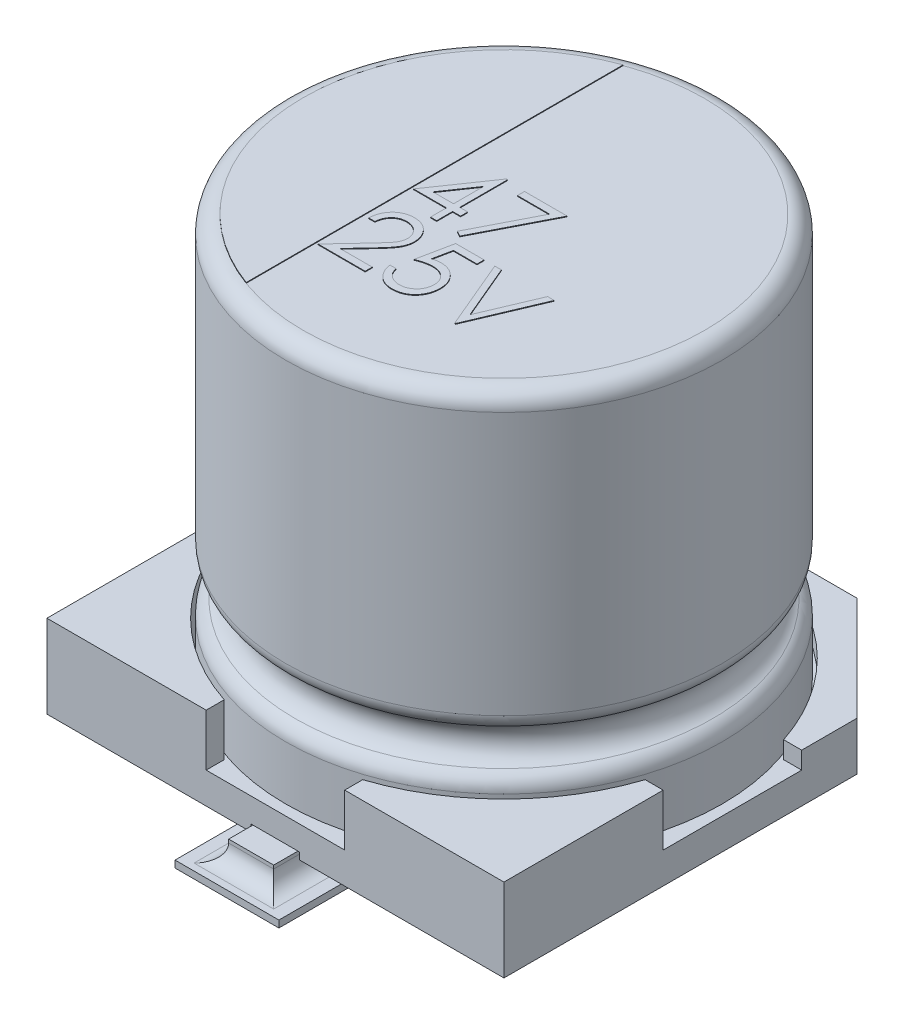
from build123d import *

# Parameters (mm, degrees)
BOSS_EXTRUDE1_START   = 0.3
SKETCH1_W             = 6.6
SKETCH1_H             = 6.6
BOSS_EXTRUDE1_DEPTH   = 1.2
SKETCH2_W             = 2
SKETCH2_H             = 2
CUT_EXTRUDE1_DEPTH    = 0.75
CUT_EXTRUDE2_DEPTH    = 0.5
CHAMFER1_SIZE         = 1.5
CUT_EXTRUDE3_DEPTH    = 0.1
BOSS_EXTRUDE2_DEPTH   = 0.4
BOSS_EXTRUDE2_2_DEPTH = 0.4
SKETCH7_R             = 0.5
BOSS_EXTRUDE3_DEPTH   = 0.3
SKETCH8_W             = 1.5
SKETCH8_H             = 2
BOSS_EXTRUDE4_DEPTH   = 0.1
FILLET1_R             = 0.25
FILLET2_R             = 0.25
BOSS_EXTRUDE5_DEPTH   = 0.01
BOSS_EXTRUDE5_2_DEPTH = 0.01
BOSS_EXTRUDE5_3_DEPTH = 0.01
BOSS_EXTRUDE5_4_DEPTH = 0.01
BOSS_EXTRUDE5_5_DEPTH = 0.01
BOSS_EXTRUDE5_6_DEPTH = 0.01


with BuildPart() as part:
    # Sketch1 → Boss-Extrude1 (new body)
    with BuildSketch(Plane(origin=(0, 0, 0), x_dir=(1, 0, 0), z_dir=(0, 1, 0)).offset(BOSS_EXTRUDE1_START)):
        Rectangle(SKETCH1_W, SKETCH1_H)
    extrude(amount=BOSS_EXTRUDE1_DEPTH)

    # Sketch2 → Cut-Extrude1 (cut)
    with BuildSketch(Plane(origin=(0, 1.5, 0), x_dir=(1, 0, 0), z_dir=(0, 1, 0))):
        Rectangle(SKETCH2_W, SKETCH2_H)
        with BuildLine():
            Line((1, -1), (-1, -1))
            Line((-1, -1), (-1, -3.039736831))
            ThreePointArc((-1, -3.039736831), (0, -3.2), (1, -3.039736831))
            Line((1, -3.039736831), (1, -1))
        make_face()
        with BuildLine():
            Line((3.039736831, 1), (1, 1))
            Line((1, 1), (1, -1))
            Line((1, -1), (3.039736831, -1))
            ThreePointArc((3.039736831, -1), (3.159680194, -0.506380362), (3.2, 0))
            ThreePointArc((3.2, 0), (3.159680194, 0.506380362), (3.039736831, 1))
        make_face()
        with BuildLine():
            Line((-1, 3.039736831), (-1, 1))
            Line((-1, 1), (1, 1))
            Line((1, 1), (1, 3.039736831))
            ThreePointArc((1, 3.039736831), (0, 3.2), (-1, 3.039736831))
        make_face()
        with BuildLine():
            Line((-1, 1), (-3.039736831, 1))
            ThreePointArc((-3.039736831, 1), (-3.2, 0), (-3.039736831, -1))
            Line((-3.039736831, -1), (-1, -1))
            Line((-1, -1), (-1, 1))
        make_face()
        with BuildLine():
            Line((-3.039736831, 1), (-3.3, 1))
            Line((-3.3, 1), (-3.3, -1))
            Line((-3.3, -1), (-3.039736831, -1))
            ThreePointArc((-3.039736831, -1), (-3.2, 0), (-3.039736831, 1))
        make_face()
        with BuildLine():
            Line((-1, 3.3), (-1, 3.039736831))
            ThreePointArc((-1, 3.039736831), (0, 3.2), (1, 3.039736831))
            Line((1, 3.039736831), (1, 3.3))
            Line((1, 3.3), (-1, 3.3))
        make_face()
        with BuildLine():
            Line((3.3, 1), (3.039736831, 1))
            ThreePointArc((3.039736831, 1), (3.159680194, 0.506380362), (3.2, 0))
            ThreePointArc((3.2, 0), (3.159680194, -0.506380362), (3.039736831, -1))
            Line((3.039736831, -1), (3.3, -1))
            Line((3.3, -1), (3.3, 1))
        make_face()
        with BuildLine():
            ThreePointArc((1, -3.039736831), (0, -3.2), (-1, -3.039736831))
            Line((-1, -3.039736831), (-1, -3.3))
            Line((-1, -3.3), (1, -3.3))
            Line((1, -3.3), (1, -3.039736831))
        make_face()
        with BuildLine():
            Line((-1, -1), (-3.039736831, -1))
            ThreePointArc((-3.039736831, -1), (-2.2627417, -2.2627417), (-1, -3.039736831))
            Line((-1, -3.039736831), (-1, -1))
        make_face()
        with BuildLine():
            ThreePointArc((-1, 3.039736831), (-2.2627417, 2.2627417), (-3.039736831, 1))
            Line((-3.039736831, 1), (-1, 1))
            Line((-1, 1), (-1, 3.039736831))
        make_face()
        with BuildLine():
            Line((1, 3.039736831), (1, 1))
            Line((1, 1), (3.039736831, 1))
            ThreePointArc((3.039736831, 1), (2.2627417, 2.2627417), (1, 3.039736831))
        make_face()
        with BuildLine():
            Line((3.039736831, -1), (1, -1))
            Line((1, -1), (1, -3.039736831))
            ThreePointArc((1, -3.039736831), (2.2627417, -2.2627417), (3.039736831, -1))
        make_face()
    extrude(amount=-CUT_EXTRUDE1_DEPTH, mode=Mode.SUBTRACT)

    # Sketch3 → Cut-Extrude2 (cut)
    with BuildSketch(Plane(origin=(0, 1.5, 0), x_dir=(1, 0, 0), z_dir=(0, 1, 0))):
        with BuildLine():
            Line((-3.3, 3.3), (-3.3, 1))
            Line((-3.3, 1), (-3.039736831, 1))
            ThreePointArc((-3.039736831, 1), (-2.2627417, 2.2627417), (-1, 3.039736831))
            Line((-1, 3.039736831), (-1, 3.3))
            Line((-1, 3.3), (-3.3, 3.3))
        make_face()
        with BuildLine():
            Line((3.3, 3.3), (1, 3.3))
            Line((1, 3.3), (1, 3.039736831))
            ThreePointArc((1, 3.039736831), (2.2627417, 2.2627417), (3.039736831, 1))
            Line((3.039736831, 1), (3.3, 1))
            Line((3.3, 1), (3.3, 3.3))
        make_face()
    extrude(amount=-CUT_EXTRUDE2_DEPTH, mode=Mode.SUBTRACT)

    # Chamfer1
    chamfer1_edges = [part.edges().sort_by_distance(p)[0] for p in [
        (-3.3, 0.65, -3.3),
        (3.3, 0.65, -3.3),
    ]]
    chamfer(chamfer1_edges, length=CHAMFER1_SIZE)

    # Sketch5 → Cut-Extrude3 (cut)
    with BuildSketch(Plane.XZ.offset(-0.3)):
        with BuildLine():
            Line((-0.35, -3.3), (0.35, -3.3))
            Line((0.35, -3.3), (0.498675617, -1.261367968))
            ThreePointArc((0.498675617, -1.261367968), (0, -0.725), (-0.498675617, -1.261367968))
            Line((-0.498675617, -1.261367968), (-0.35, -3.3))
        make_face()
        with BuildLine():
            Line((-0.35, 3.3), (0.35, 3.3))
            Line((0.35, 3.3), (0.498675617, 1.261367968))
            ThreePointArc((0.498675617, 1.261367968), (0, 0.725), (-0.498675617, 1.261367968))
            Line((-0.498675617, 1.261367968), (-0.35, 3.3))
        make_face()
    extrude(amount=-CUT_EXTRUDE3_DEPTH, mode=Mode.SUBTRACT)

    # Sketch7 → Boss-Extrude3 (add)
    with BuildSketch(Plane.XZ.offset(-0.3)):
        with Locations(Location((-2, 2, 0), (0, 0, 90))):
            Circle(SKETCH7_R)
        with Locations(Location((2, 2, 0), (0, 0, 90))):
            Circle(SKETCH7_R)
        with Locations(Location((2, -2, 0), (0, 0, 90))):
            Circle(SKETCH7_R)
        with Locations(Location((-2, -2, 0), (0, 0, 90))):
            Circle(SKETCH7_R)
    extrude(amount=BOSS_EXTRUDE3_DEPTH)


with BuildPart() as body_2:
    # Sketch4 → Revolve1 (revolve)
    with BuildSketch(Plane(origin=(0, 0, 0), x_dir=(0, 0, -1), z_dir=(1, 0, 0)), mode=Mode.PRIVATE) as revolve1_sk:
        with BuildLine():
            Line((-3.15, 0.75), (0, 0.75))
            Line((0, 0.75), (0, 6.55))
            Line((0, 6.55), (-2.9, 6.55))
            ThreePointArc((-2.9, 6.55), (-3.076776695, 6.476776695), (-3.15, 6.3))
            Line((-3.15, 6.3), (-3.15, 2.507115011))
            ThreePointArc((-3.15, 2.507115011), (-3.113200716, 2.376556769), (-3.013636364, 2.284434126))
            ThreePointArc((-3.013636364, 2.284434126), (-2.85, 2.017217063), (-3.013636364, 1.75))
            ThreePointArc((-3.013636364, 1.75), (-3.113200716, 1.657877356), (-3.15, 1.527319114))
            Line((-3.15, 1.527319114), (-3.15, 0.75))
        make_face()
    revolve(revolve1_sk.sketch.rotate(Axis((0, 0.75, 0), (0, 1, 0)), 180), axis=Axis((0, 0.75, 0), (0, 1, 0)))


with BuildPart() as body_3:
    # Sketch6 → Boss-Extrude2 (new body)
    with BuildSketch(Plane.XZ.offset(-0.4)):
        with BuildLine():
            Line((-0.325, 3.65), (0.325, 3.65))
            Line((0.325, 3.65), (0.325, 1.225))
            ThreePointArc((0.325, 1.225), (0, 0.9), (-0.325, 1.225))
            Line((-0.325, 1.225), (-0.325, 3.65))
        make_face()
    extrude(amount=BOSS_EXTRUDE2_DEPTH)



with BuildPart() as body_4:
    # Sketch6 → Boss-Extrude2 2 (new body)
    with BuildSketch(Plane.XZ.offset(-0.4)):
        with BuildLine():
            Line((0.325, -3.65), (0.325, -1.225))
            ThreePointArc((0.325, -1.225), (0, -0.9), (-0.325, -1.225))
            Line((-0.325, -1.225), (-0.325, -3.65))
            Line((-0.325, -3.65), (0.325, -3.65))
        make_face()
    extrude(amount=BOSS_EXTRUDE2_2_DEPTH)


with BuildPart() as body_3_1:
    add(body_3.part)

    add(body_4.part)  # Boss-Extrude4 merges body 4
    # Sketch8 → Boss-Extrude4 (add)
    with BuildSketch(Plane.XZ):
        with Locations((0, -3)):
            Rectangle(SKETCH8_W, SKETCH8_H)
        with Locations((0, 3)):
            Rectangle(SKETCH8_W, SKETCH8_H)
    extrude(amount=-BOSS_EXTRUDE4_DEPTH)

    # Fillet1
    fillet1_edges = [body_3_1.edges().sort_by_distance(p)[0] for p in [
        (-0.325, 0.1, 2.825),
        (0, 0.1, 3.65),
        (0.325, 0.1, 2.825),
    ]]
    fillet(fillet1_edges, radius=FILLET1_R)

    # Fillet2
    fillet2_edges = [body_3_1.edges().sort_by_distance(p)[0] for p in [
        (0.325, 0.1, -2.825),
        (0, 0.1, -3.65),
        (-0.325, 0.1, -2.825),
    ]]
    fillet(fillet2_edges, radius=FILLET2_R)


with BuildPart() as body_4_2:
    # Sketch9 → Boss-Extrude5 (new body)
    with BuildSketch(Plane(origin=(0, 6.55, 0), x_dir=(1, 0, 0), z_dir=(0, 1, 0))):
        with BuildLine():
            Line((-1, -2.722131518), (-1, -1.722131518))
            Line((-1, -1.722131518), (-1, -0.574043839))
            Line((-1, -0.574043839), (-1, 0.574043839))
            Line((-1, 0.574043839), (-1, 1.722131518))
            Line((-1, 1.722131518), (-1, 2.722131518))
            ThreePointArc((-1, 2.722131518), (-2.9, 0), (-1, -2.722131518))
        make_face()
    extrude(amount=BOSS_EXTRUDE5_DEPTH)


with BuildPart() as body_5:
    # Sketch9 → Boss-Extrude5 2 (new body)
    with BuildSketch(Plane(origin=(0, 6.55, 0), x_dir=(1, 0, 0), z_dir=(0, 1, 0))):
        Polygon((-0.415665064, 0.451597186), (-0.397435897, 0.451597186), (-0.397435897, -0.240710506), (-0.282051282, -0.240710506), (-0.282051282, -0.343274608), (-0.397435897, -0.343274608), (-0.397435897, -0.574043839), (-0.487179487, -0.574043839), (-0.487179487, -0.343274608), (-0.961538462, -0.343274608), align=None)
        Polygon((-0.487179487, -0.240710506), (-0.487179487, 0.193584366), (-0.78525641, -0.240710506), align=None, mode=Mode.SUBTRACT)
    extrude(amount=BOSS_EXTRUDE5_2_DEPTH)


with BuildPart() as body_6:
    # Sketch9 → Boss-Extrude5 3 (new body)
    with BuildSketch(Plane(origin=(0, 6.55, 0), x_dir=(1, 0, 0), z_dir=(0, 1, 0))):
        Polygon((-0.128205128, 0.425956161), (0.487179487, 0.425956161), (-0.038461538, -0.599684865), (-0.115985577, -0.557016596), (0.335336538, 0.323392058), (-0.128205128, 0.323392058), align=None)
    extrude(amount=BOSS_EXTRUDE5_3_DEPTH)


with BuildPart() as body_7:
    # Sketch9 → Boss-Extrude5 4 (new body)
    with BuildSketch(Plane(origin=(0, 6.55, 0), x_dir=(1, 0, 0), z_dir=(0, 1, 0))):
        with BuildLine():
            Line((-0.833333333, -1.029823825), (-0.923076923, -1.029823825))
            add(Edge.make_bspline(
                [(-0.923076923, -1.029823825), (-0.922492022, -1.017917858), (-0.921343292, -0.994534853), (-0.915963781, -0.960442309), (-0.908266388, -0.927855223), (-0.897383115, -0.897035248), (-0.883867036, -0.867709874), (-0.867658457, -0.839995584), (-0.848460214, -0.813998102), (-0.826686861, -0.789958432), (-0.803038678, -0.767904841), (-0.777522696, -0.748860485), (-0.750709831, -0.732769722), (-0.722681431, -0.719317939), (-0.69312127, -0.70922084), (-0.662297596, -0.701728943), (-0.630074986, -0.697221416), (-0.608120694, -0.696736905), (-0.596955128, -0.696490492)],
                knots=[0, 0, 0, 0, 1.10065271, 2.161652631, 3.183658789, 4.190468796, 5.17591951, 6.163126047, 7.15150782, 8.156236427, 9.156009102, 10.134482811, 11.092018607, 12.041330605, 13.001268258, 13.972401359, 14.968799086, 16, 16, 16, 16], degree=3))
            add(Edge.make_bspline(
                [(-0.596955128, -0.696490492), (-0.585989964, -0.696747194), (-0.564443809, -0.697251604), (-0.532997519, -0.701583327), (-0.503061149, -0.708367781), (-0.474693216, -0.717886472), (-0.448120054, -0.730682022), (-0.423142042, -0.746052748), (-0.39946181, -0.763829842), (-0.378145586, -0.784759503), (-0.358571849, -0.807103042), (-0.34168549, -0.830956729), (-0.327224587, -0.855593667), (-0.315170964, -0.881201725), (-0.306297781, -0.908022019), (-0.29956115, -0.935664077), (-0.295753318, -0.964414023), (-0.295168911, -0.983873039), (-0.294871795, -0.993766133)],
                knots=[0, 0, 0, 0, 1.111607364, 2.184268762, 3.212621178, 4.221274766, 5.211760367, 6.196651075, 7.1921475, 8.207485113, 9.220403448, 10.201281604, 11.166441695, 12.114753415, 13.065576456, 14.026450734, 14.996634279, 16, 16, 16, 16], degree=3))
            add(Edge.make_bspline(
                [(-0.294871795, -0.993766133), (-0.295355584, -1.007694086), (-0.296314673, -1.035305576), (-0.304518781, -1.075881251), (-0.31733207, -1.115193656), (-0.332759886, -1.146832885), (-0.348323441, -1.172328169), (-0.362348444, -1.193319228), (-0.378766961, -1.21592079), (-0.39781796, -1.240057172), (-0.419107352, -1.265917431), (-0.442827971, -1.293485944), (-0.469148965, -1.322477878), (-0.487622823, -1.342279478), (-0.497195513, -1.352540172)],
                knots=[0, 0, 0, 0, 1.184426356, 2.348067706, 3.509069118, 4.696110526, 5.333549288, 6.050745305, 6.844228056, 7.710549037, 8.667450064, 9.695053472, 10.805634456, 12, 12, 12, 12], degree=3))
            Line((-0.497195513, -1.352540172), (-0.747395833, -1.619567415))
            Line((-0.747395833, -1.619567415), (-0.282051282, -1.619567415))
            Line((-0.282051282, -1.619567415), (-0.282051282, -1.722131518))
            Line((-0.282051282, -1.722131518), (-0.961538462, -1.722131518))
            Line((-0.961538462, -1.722131518), (-0.573717949, -1.308269338))
            add(Edge.make_bspline(
                [(-0.573717949, -1.308269338), (-0.564275695, -1.298412679), (-0.546139059, -1.279480055), (-0.520486894, -1.251839209), (-0.497447183, -1.226196483), (-0.476870785, -1.202600326), (-0.45920407, -1.180705592), (-0.443526289, -1.161221391), (-0.430964692, -1.143291549), (-0.417331721, -1.122508516), (-0.404127727, -1.097133568), (-0.392781339, -1.066123943), (-0.385862811, -1.034201871), (-0.385032858, -1.01262986), (-0.384615385, -1.001778954)],
                knots=[0, 0, 0, 0, 1.329631726, 2.553950428, 3.673215718, 4.687767853, 5.603093632, 6.413772471, 7.123043292, 7.734684054, 8.834405432, 9.900288307, 10.943827018, 12, 12, 12, 12], degree=3))
            add(Edge.make_bspline(
                [(-0.384615385, -1.001778954), (-0.384797025, -0.994955697), (-0.385155004, -0.981508368), (-0.388314346, -0.961792437), (-0.393088777, -0.942773919), (-0.399930279, -0.924394313), (-0.408960776, -0.906838413), (-0.41995317, -0.890084847), (-0.432636046, -0.873888), (-0.447307837, -0.858701343), (-0.463425414, -0.844792427), (-0.480452342, -0.83247126), (-0.498466658, -0.822174371), (-0.517392407, -0.813733372), (-0.537176827, -0.807111835), (-0.557858183, -0.802523669), (-0.57937933, -0.799642959), (-0.594074615, -0.799253196), (-0.6015625, -0.799054595)],
                knots=[0, 0, 0, 0, 0.991446411, 1.95395049, 2.89581595, 3.838931463, 4.798493298, 5.75982156, 6.748411868, 7.785213223, 8.824556874, 9.840280684, 10.836137867, 11.835679398, 12.848801643, 13.863922112, 14.911575587, 16, 16, 16, 16], degree=3))
            add(Edge.make_bspline(
                [(-0.6015625, -0.799054595), (-0.609382738, -0.79925889), (-0.624740394, -0.799660091), (-0.647288689, -0.802466567), (-0.668798911, -0.807308235), (-0.689325169, -0.813930142), (-0.708902194, -0.82234687), (-0.727434778, -0.832830226), (-0.744881318, -0.845339796), (-0.76127461, -0.859522812), (-0.776378604, -0.875313555), (-0.78964914, -0.892916401), (-0.801244573, -0.912009949), (-0.811361496, -0.932542677), (-0.819577408, -0.9547009), (-0.825855451, -0.978405959), (-0.830823121, -1.003554925), (-0.832482699, -1.020922092), (-0.833333333, -1.029823825)],
                knots=[0, 0, 0, 0, 1.031018746, 2.02475058, 2.990194455, 3.934040569, 4.864654155, 5.795059489, 6.735614925, 7.690564532, 8.649604399, 9.611025574, 10.590972636, 11.591080095, 12.624614302, 13.701020113, 14.821632451, 16, 16, 16, 16], degree=3))
        make_face()
    extrude(amount=BOSS_EXTRUDE5_4_DEPTH)


with BuildPart() as body_8:
    # Sketch9 → Boss-Extrude5 5 (new body)
    with BuildSketch(Plane(origin=(0, 6.55, 0), x_dir=(1, 0, 0), z_dir=(0, 1, 0))):
        with BuildLine():
            Line((0.435897436, -0.722131518), (0.435897436, -0.82469562))
            Line((0.435897436, -0.82469562), (0.095753205, -0.82469562))
            Line((0.095753205, -0.82469562), (0.041866987, -1.087716454))
            add(Edge.make_bspline(
                [(0.041866987, -1.087716454), (0.05245438, -1.084793519), (0.072965779, -1.079130795), (0.103240025, -1.072843432), (0.131980654, -1.069053305), (0.15063076, -1.068535788), (0.159655449, -1.068285364)],
                knots=[0, 0, 0, 0, 1.100273476, 2.13160584, 3.095893838, 4, 4, 4, 4], degree=3))
            add(Edge.make_bspline(
                [(0.159655449, -1.068285364), (0.170822231, -1.06852706), (0.192778916, -1.069002294), (0.22490433, -1.07356568), (0.255570871, -1.080748513), (0.284714405, -1.090782947), (0.312388848, -1.1036143), (0.33833958, -1.119642854), (0.362956127, -1.138366663), (0.385796868, -1.159893809), (0.406518099, -1.1835857), (0.424736953, -1.209059377), (0.440211979, -1.236067281), (0.452657909, -1.264867455), (0.46259629, -1.295141499), (0.469211145, -1.327207951), (0.473615919, -1.360764556), (0.47410803, -1.383708719), (0.474358974, -1.395408761)],
                knots=[0, 0, 0, 0, 1.052922333, 2.070308379, 3.05430497, 4.020497103, 4.973039431, 5.925935799, 6.892292201, 7.88610001, 8.88166317, 9.857072816, 10.836096531, 11.812156883, 12.81219415, 13.836441305, 14.89672472, 16, 16, 16, 16], degree=3))
            add(Edge.make_bspline(
                [(0.474358974, -1.395408761), (0.474168953, -1.403557967), (0.473791478, -1.419746249), (0.471871881, -1.44378745), (0.468175962, -1.467319688), (0.463213756, -1.490346085), (0.456773065, -1.512823049), (0.448976192, -1.534814914), (0.43943447, -1.556184801), (0.428968363, -1.577134914), (0.417183655, -1.597191631), (0.404104081, -1.615948484), (0.39028537, -1.63368685), (0.375416402, -1.650216488), (0.359358975, -1.665428779), (0.342307556, -1.679414002), (0.324398208, -1.692408668), (0.305353853, -1.703885295), (0.285598858, -1.71444614), (0.264847938, -1.723110008), (0.243573453, -1.730855873), (0.221469202, -1.737030024), (0.198585256, -1.741867896), (0.174883892, -1.745153782), (0.150489414, -1.74754705), (0.133953696, -1.747696866), (0.125600962, -1.747772543)],
                knots=[0, 0, 0, 0, 1.056347294, 2.098418968, 3.122841568, 4.141288669, 5.149314143, 6.15115421, 7.162517403, 8.180376062, 9.185164535, 10.17417709, 11.141909838, 12.097768115, 13.052685741, 14.0056014, 14.954263652, 15.917497458, 16.885230207, 17.854509472, 18.828990115, 19.81800267, 20.826176721, 21.857883937, 22.917946725, 24, 24, 24, 24], degree=3))
            add(Edge.make_bspline(
                [(0.125600962, -1.747772543), (0.11563691, -1.747575161), (0.096033815, -1.747186835), (0.067313653, -1.74312441), (0.039680909, -1.737306149), (0.013358023, -1.728552929), (-0.01189091, -1.71758513), (-0.035725972, -1.703723367), (-0.058756194, -1.688015052), (-0.080045347, -1.669477808), (-0.099804236, -1.649216184), (-0.11749181, -1.627228287), (-0.133244261, -1.603877018), (-0.146809332, -1.579048974), (-0.158380195, -1.552809393), (-0.167470191, -1.525059965), (-0.174806864, -1.495945678), (-0.177910699, -1.475901818), (-0.179487179, -1.465721261)],
                knots=[0, 0, 0, 0, 1.0467383, 2.05933395, 3.04377827, 4.011590433, 4.970194871, 5.932262533, 6.905835911, 7.896367577, 8.894135286, 9.877477877, 10.858688626, 11.851381753, 12.8477658, 13.868841284, 14.917554742, 16, 16, 16, 16], degree=3))
            Line((-0.179487179, -1.465721261), (-0.08974359, -1.465721261))
            add(Edge.make_bspline(
                [(-0.08974359, -1.465721261), (-0.08753543, -1.475257391), (-0.083291226, -1.493586361), (-0.073975298, -1.519338172), (-0.062585047, -1.542286522), (-0.049040948, -1.562734974), (-0.032883796, -1.580566116), (-0.014446817, -1.596456706), (0.006223961, -1.610792457), (0.029193456, -1.622741819), (0.053425764, -1.632932891), (0.078787824, -1.63971909), (0.104589066, -1.644490774), (0.122040029, -1.644968419), (0.130809295, -1.645208441)],
                knots=[0, 0, 0, 0, 1.136247022, 2.183929868, 3.172523383, 4.106158343, 5.02341133, 5.958108904, 6.928429099, 7.938127109, 8.96079061, 9.975095812, 10.982467395, 12, 12, 12, 12], degree=3))
            add(Edge.make_bspline(
                [(0.130809295, -1.645208441), (0.13936885, -1.644973933), (0.156222685, -1.644512185), (0.181025939, -1.640958181), (0.204972474, -1.635484589), (0.227826005, -1.627293202), (0.249986445, -1.617337569), (0.270893236, -1.604561833), (0.291151201, -1.58985897), (0.310130668, -1.573014219), (0.327513367, -1.554451449), (0.342872259, -1.534600765), (0.355665663, -1.513424523), (0.366446837, -1.491289337), (0.374633494, -1.467952606), (0.380473774, -1.443523699), (0.38390322, -1.417942276), (0.384374985, -1.400493902), (0.384615385, -1.391602672)],
                knots=[0, 0, 0, 0, 1.027316725, 2.022795036, 3.002884548, 3.971462791, 4.93288096, 5.914575861, 6.907176829, 7.935150275, 8.956128384, 9.956726525, 10.942570165, 11.921478529, 12.907843606, 13.90538589, 14.932640048, 16, 16, 16, 16], degree=3))
            add(Edge.make_bspline(
                [(0.384615385, -1.391602672), (0.384427248, -1.383581028), (0.384058996, -1.367879803), (0.381050262, -1.344908601), (0.375816841, -1.323173446), (0.368552875, -1.302569379), (0.359330159, -1.283076967), (0.348059784, -1.264676093), (0.334530242, -1.247609283), (0.319075416, -1.231868554), (0.302144548, -1.217341447), (0.283446335, -1.204957422), (0.263372071, -1.19453916), (0.242163614, -1.185548303), (0.2193165, -1.179090947), (0.195283176, -1.17424298), (0.169804117, -1.171438591), (0.15238392, -1.17104948), (0.143429487, -1.170849466)],
                knots=[0, 0, 0, 0, 1.045622112, 2.046656509, 3.013763289, 3.955457236, 4.890082067, 5.820317437, 6.762574623, 7.722996705, 8.69280354, 9.665887285, 10.63943826, 11.638615906, 12.663482002, 13.728887084, 14.832589034, 16, 16, 16, 16], degree=3))
            add(Edge.make_bspline(
                [(0.143429487, -1.170849466), (0.135678365, -1.17101535), (0.119674263, -1.171357856), (0.095124884, -1.173879713), (0.069327249, -1.177948082), (0.04238025, -1.183544153), (0.014202962, -1.190867318), (-0.015145152, -1.19964289), (-0.0457258, -1.210134889), (-0.066330864, -1.218058379), (-0.076923077, -1.222131518)],
                knots=[0, 0, 0, 0, 0.817624296, 1.688186739, 2.600797293, 3.572016777, 4.590301741, 5.671205678, 6.80286297, 8, 8, 8, 8], degree=3))
            Line((-0.076923077, -1.222131518), (0.025641026, -0.722131518))
            Line((0.025641026, -0.722131518), (0.435897436, -0.722131518))
        make_face()
    extrude(amount=BOSS_EXTRUDE5_5_DEPTH)


with BuildPart() as body_9:
    # Sketch9 → Boss-Extrude5 6 (new body)
    with BuildSketch(Plane(origin=(0, 6.55, 0), x_dir=(1, 0, 0), z_dir=(0, 1, 0))):
        Polygon((0.58974359, -0.722131518), (0.685897436, -0.722131518), (1.019230769, -1.510192415), (1.352564103, -0.722131518), (1.448717949, -0.722131518), (1.025641026, -1.722131518), (1.012820513, -1.722131518), align=None)
    extrude(amount=BOSS_EXTRUDE5_6_DEPTH)


solid = Compound([part.part, body_2.part, body_3_1.part, body_4_2.part, body_5.part, body_6.part, body_7.part, body_8.part, body_9.part])
